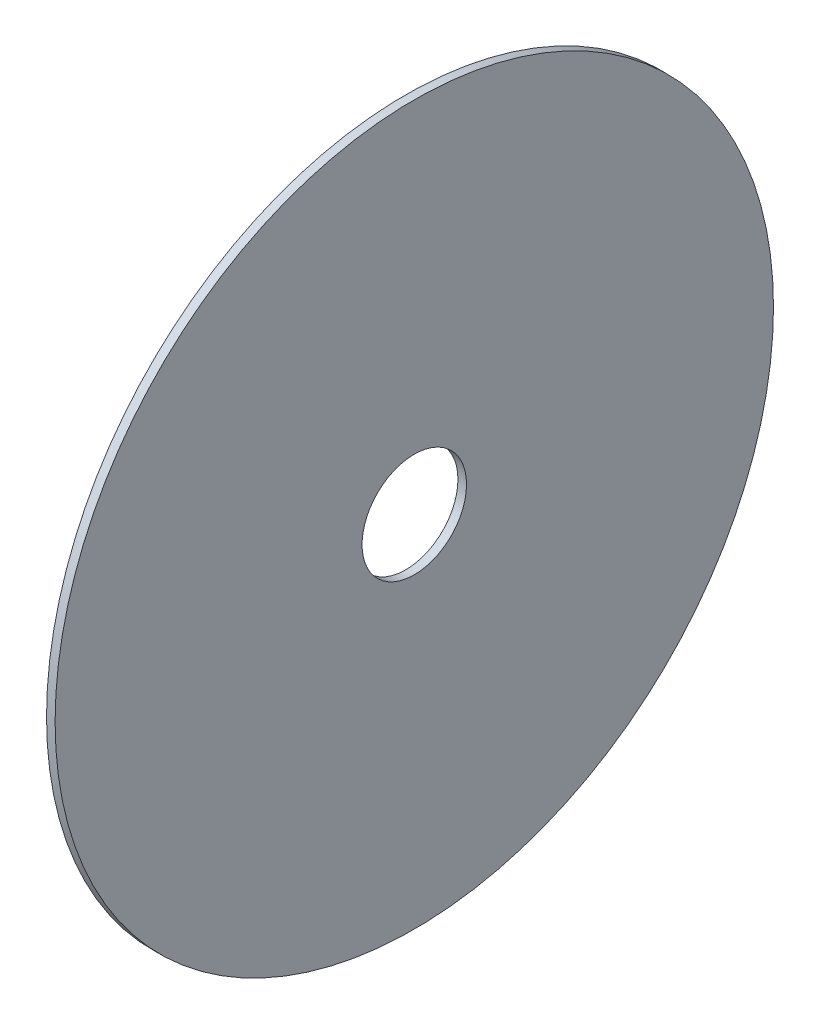
from build123d import *

# Parameters (mm, degrees)
SKETCH1_R           = 251
BOSS_EXTRUDE1_DEPTH = 6
SKETCH2_R           = 36.5
CUT_EXTRUDE1_DEPTH  = 356.018309387


with BuildPart() as part:
    # Sketch1 → Boss-Extrude1 (new body)
    with BuildSketch(Plane(origin=(0, 0, 0), x_dir=(0, 0, -1), z_dir=(1, 0, 0))):
        Circle(SKETCH1_R)
    extrude(amount=BOSS_EXTRUDE1_DEPTH)

    # Sketch2 → Cut-Extrude1 (cut, through all)
    with BuildSketch(Plane(origin=(6, 0, 0), x_dir=(0, 0, -1), z_dir=(1, 0, 0))):
        Circle(SKETCH2_R)
    extrude(amount=-CUT_EXTRUDE1_DEPTH, mode=Mode.SUBTRACT)


solid = part.part
